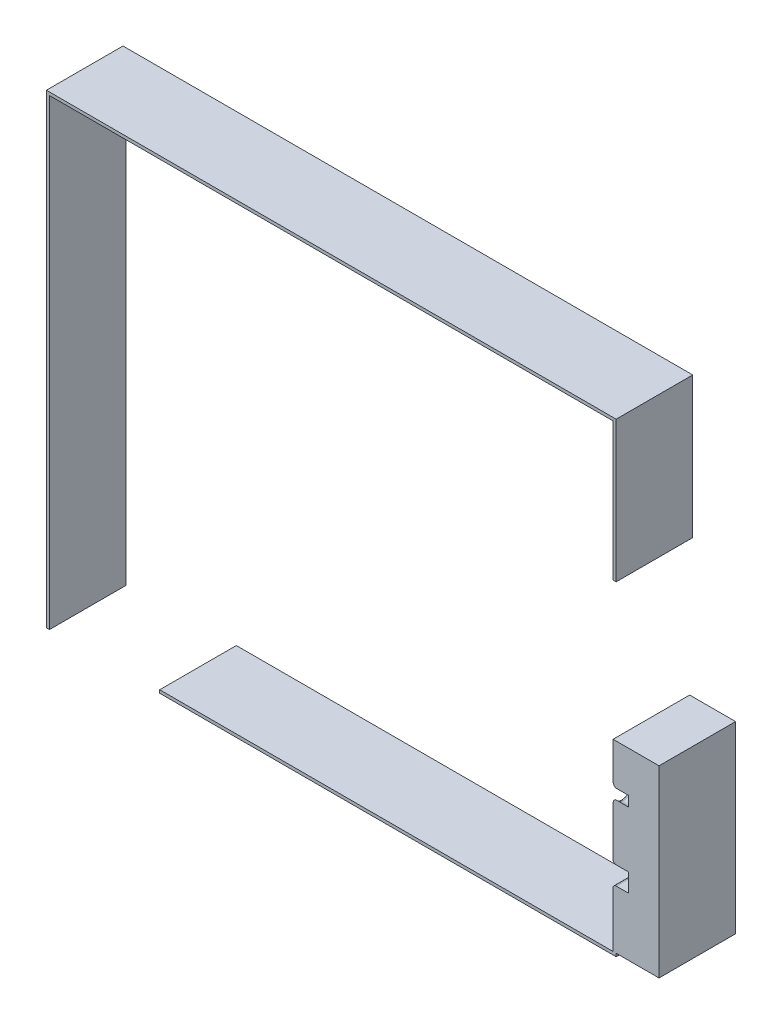
from build123d import *

# Parameters (mm, degrees)
SKETCH2_W           = 1860
SKETCH2_H           = 1520
BOSS_EXTRUDE1_DEPTH = 260
SKETCH3_W           = 1840
SKETCH3_H           = 1500
CUT_EXTRUDE1_DEPTH  = 250
SKETCH5_W           = 250
SKETCH5_H           = 600
BOSS_EXTRUDE2_DEPTH = 140
CUT_EXTRUDE2_DEPTH  = 51
SKETCH7_W           = 60
SKETCH7_H           = 60
CUT_EXTRUDE3_DEPTH  = 51
FILLET1_R           = 10
SKETCH8_W           = 360
SKETCH8_H           = 250
CUT_EXTRUDE4_DEPTH  = 10
SKETCH9_W           = 250
SKETCH9_H           = 450
CUT_EXTRUDE5_DEPTH  = 10
SKETCH10_W          = 1860
SKETCH10_H          = 1520
CUT_EXTRUDE6_DEPTH  = 10


with BuildPart() as part:
    # Sketch2 → Boss-Extrude1 (new body)
    with BuildSketch(Plane.XY):
        with Locations((-155.498007968, -59.043824701)):
            Rectangle(SKETCH2_W, SKETCH2_H)
    extrude(amount=BOSS_EXTRUDE1_DEPTH)

    # Sketch3 → Cut-Extrude1 (cut)
    with BuildSketch(Plane(origin=(0, 0, 0), x_dir=(-1, 0, 0), z_dir=(0, 0, -1))):
        with Locations((155.498007968, -59.043824701)):
            Rectangle(SKETCH3_W, SKETCH3_H)
    extrude(amount=-CUT_EXTRUDE1_DEPTH, mode=Mode.SUBTRACT)

    # Sketch5 → Boss-Extrude2 (add)
    with BuildSketch(Plane(origin=(774.501992032, 0, 0), x_dir=(0, 0, -1), z_dir=(1, 0, 0))):
        with Locations((-125, -509.043824701)):
            Rectangle(SKETCH5_W, SKETCH5_H)
    extrude(amount=BOSS_EXTRUDE2_DEPTH)

    # Sketch6 → Cut-Extrude2 (cut)
    with BuildSketch(Plane.ZY.offset(-764.501992032)):
        with BuildLine():
            ThreePointArc((250, -342.460700749), (195, -359.043824701), (250, -375.626948653))
            Line((250, -375.626948653), (250, -342.460700749))
        make_face()
    extrude(amount=-CUT_EXTRUDE2_DEPTH, mode=Mode.SUBTRACT)

    # Sketch7 → Cut-Extrude3 (cut)
    with BuildSketch(Plane.ZY.offset(-764.501992032)):
        with Locations((220, -589.043824701)):
            Rectangle(SKETCH7_W, SKETCH7_H)
    extrude(amount=-CUT_EXTRUDE3_DEPTH, mode=Mode.SUBTRACT)

    # Fillet1
    fillet1_edges = [part.edges().sort_by_distance(p)[0] for p in [
        (764.501992032, -559.043824701, 220),
        (764.501992032, -589.043824701, 190),
        (764.501992032, -619.043824701, 220),
        (764.501992032, -359.043824701, 195),
    ]]
    fillet(fillet1_edges, radius=FILLET1_R)

    # Sketch8 → Cut-Extrude4 (cut)
    with BuildSketch(Plane.XZ.offset(819.043824701)):
        with Locations((-895.498007968, 125)):
            Rectangle(SKETCH8_W, SKETCH8_H)
    extrude(amount=-CUT_EXTRUDE4_DEPTH, mode=Mode.SUBTRACT)

    # Sketch9 → Cut-Extrude5 (cut)
    with BuildSketch(Plane(origin=(774.501992032, 0, 0), x_dir=(0, 0, -1), z_dir=(1, 0, 0))):
        with Locations((-125, 15.956175299)):
            Rectangle(SKETCH9_W, SKETCH9_H)
    extrude(amount=-CUT_EXTRUDE5_DEPTH, mode=Mode.SUBTRACT)

    # Sketch10 → Cut-Extrude6 (cut)
    with BuildSketch(Plane.XY.offset(260)):
        with Locations((-155.498007968, -59.043824701)):
            Rectangle(SKETCH10_W, SKETCH10_H)
    extrude(amount=-CUT_EXTRUDE6_DEPTH, mode=Mode.SUBTRACT)


with BuildPart() as cut_extrude6_piece_1:
    # of the separate pieces the step leaves, piece 1, a body of its own (cut_extrude6_pieces)
    add(part.part.solids().sort_by_distance((764.501992032, -327.818834709, 250))[0])


with BuildPart() as cut_extrude6_piece_2:
    # of the separate pieces the step leaves, piece 2, a body of its own (cut_extrude6_pieces)
    add(part.part.solids().sort_by_distance((774.501992032, 240.956175299, 0))[0])


solid = Compound([cut_extrude6_piece_1.part, cut_extrude6_piece_2.part])
